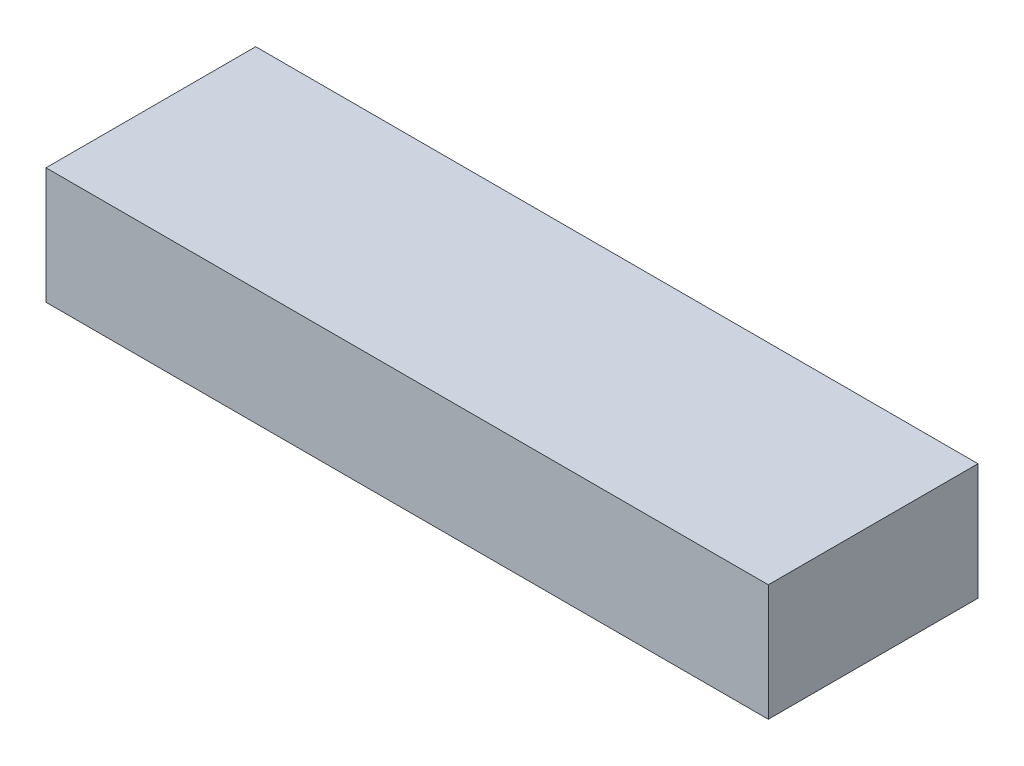
from build123d import *

# Parameters (mm, degrees)
SKETCH_1_W      = 155
SKETCH_1_H      = 45
EXTRUDE_1_DEPTH = 25


with BuildPart() as part:
    # 草图1 → 凸台-拉伸1 (new body)
    with BuildSketch(Plane(origin=(0, 0, 0), x_dir=(1, 0, 0), z_dir=(0, 1, 0))):
        Rectangle(SKETCH_1_W, SKETCH_1_H)
    extrude(amount=EXTRUDE_1_DEPTH)


solid = part.part
